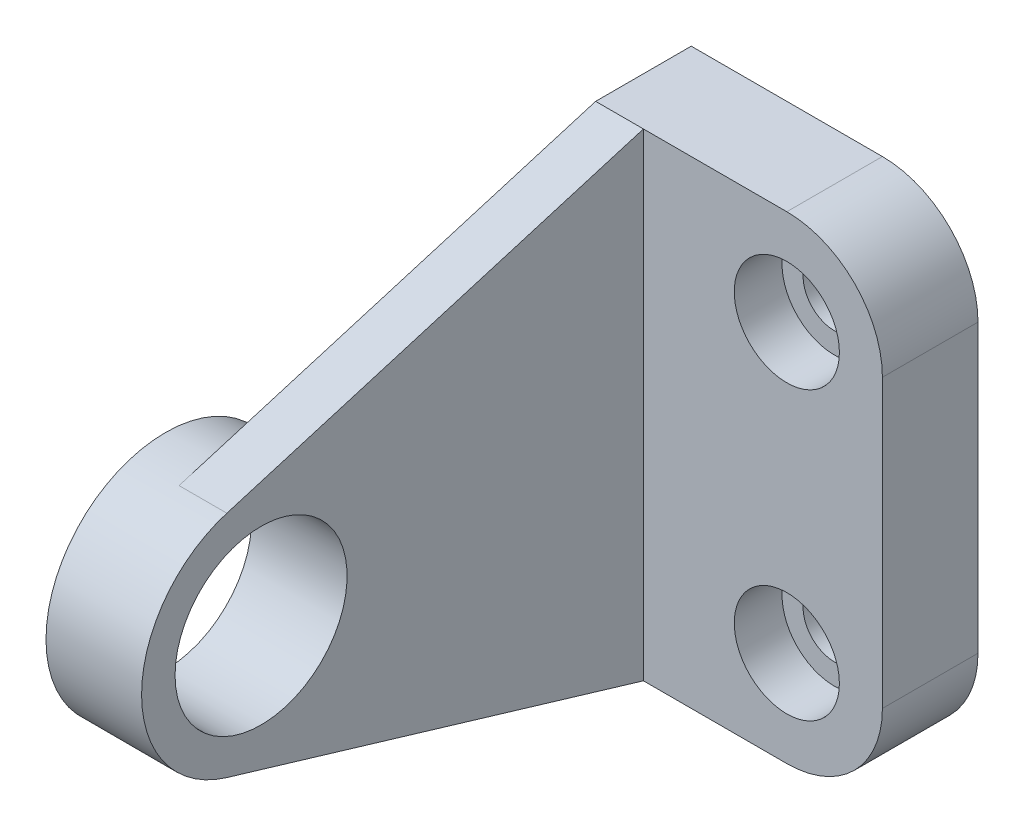
from build123d import *

# Parameters (mm, degrees)
SKETCH_1_W                = 30
SKETCH_1_H                = 50
EXTRUDE_2_DEPTH           = 10
EXTRUDE_3_DEPTH           = 5
EXTRUDE_4_DEPTH           = 5
EXTRUDE_4_DEPTH_BACK      = 5
SKETCH_2_3_R              = 9
FILLET_1_R                = 10
HOLE_WIZARD_1_D           = 6.6
HOLE_WIZARD_1_CBORE_D     = 11
HOLE_WIZARD_1_CBORE_DEPTH = 5


with BuildPart() as part:
    # 草图1 → 凸台-拉伸2 (new body)
    with BuildSketch(Plane.XY):
        Rectangle(SKETCH_1_W, SKETCH_1_H)
    extrude(amount=EXTRUDE_2_DEPTH)

    # 草图2 → 凸台-拉伸3 (add)
    with BuildSketch(Plane.ZY.offset(15)):
        with BuildLine():
            Line((10, 25), (10, -25))
            Line((10, -25), (53.579145154, -11.976632246))
            ThreePointArc((53.579145154, -11.976632246), (37.5, 0), (53.579145154, 11.976632246))
            Line((53.579145154, 11.976632246), (10, 25))
        make_face()
    extrude(amount=-EXTRUDE_3_DEPTH)

    # 草图2<3> → 凸台-拉伸4 (add, two sides: drawn at the far end of the back side and taken through both)
    with BuildSketch(Plane.ZY.offset(15).offset(-EXTRUDE_4_DEPTH_BACK)):
        with BuildLine():
            ThreePointArc((53.579145154, -11.976632246), (60.02470235, -7.466950032), (62.5, 0))
            ThreePointArc((62.5, 0), (60.02470235, 7.466950032), (53.579145154, 11.976632246))
            ThreePointArc((53.579145154, 11.976632246), (37.5, 0), (53.579145154, -11.976632246))
        make_face()
        with Locations((50, 0)):
            Circle(SKETCH_2_3_R, mode=Mode.SUBTRACT)
    extrude(amount=EXTRUDE_4_DEPTH + EXTRUDE_4_DEPTH_BACK)

    # 圆角1
    fillet_1_edges = [part.edges().sort_by_distance(p)[0] for p in [
        (15, 25, 5),
        (15, -25, 5),
    ]]
    fillet(fillet_1_edges, radius=FILLET_1_R)

    # 打孔尺寸(%根据)内六角圆柱头螺钉的类型1 (through all)
    with Locations(Plane.XY.offset(10)):
        with Locations((5, -15), (5, 15)):
            CounterBoreHole(HOLE_WIZARD_1_D / 2, HOLE_WIZARD_1_CBORE_D / 2, HOLE_WIZARD_1_CBORE_DEPTH)


solid = part.part
